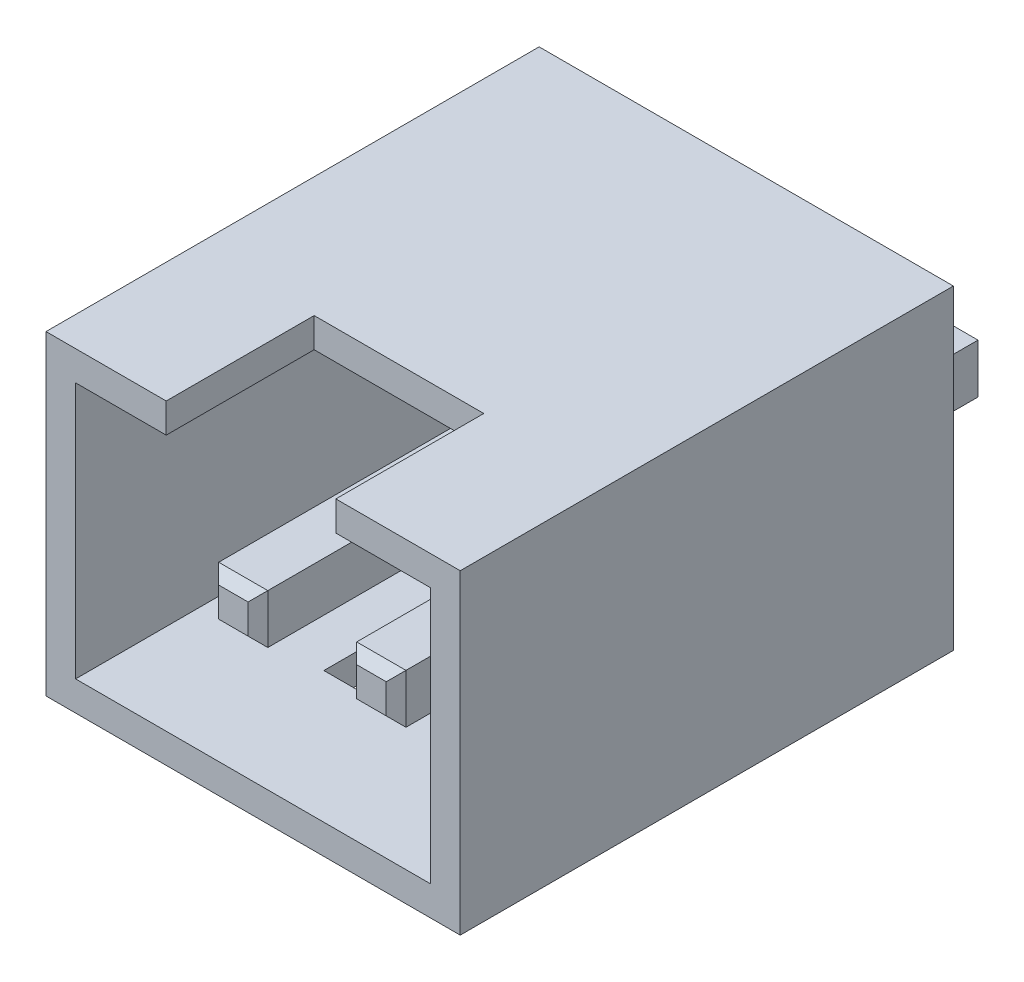
from build123d import *

# Parameters (mm, degrees)
SKETCH_1_W           = 4.2
SKETCH_1_H           = 3.2
EXTRUDE_1_DEPTH      = 5
SKETCH_2_W           = 3.6
SKETCH_2_H           = 2.6
CUT_EXTRUDE_2_DEPTH  = 4.5
SKETCH_10_W          = 1.719860591
SKETCH_10_H          = 0.3
CUT_EXTRUDE_6_DEPTH  = 1.5
EXTRUDE_2_DEPTH      = 4
EXTRUDE_2_DEPTH_BACK = 2
SKETCH_12_W          = 0.497980778
SKETCH_12_H          = 0.499968878
SKETCH_12_W_2        = 0.49954636
CHAMFER_2_SIZE       = 0.1
CHAMFER_3_SIZE       = 0.1
SKETCH_13_W          = 0.786936725
SKETCH_13_H          = 0.841611244
CUT_EXTRUDE_7_DEPTH  = 0.5


with BuildPart() as part:
    # 草图1 → 凸台-拉伸1 (new body)
    with BuildSketch(Plane.XY):
        Rectangle(SKETCH_1_W, SKETCH_1_H)
    extrude(amount=EXTRUDE_1_DEPTH)

    # 草图2 → 切除-拉伸2 (cut)
    with BuildSketch(Plane.XY.offset(5)):
        Rectangle(SKETCH_2_W, SKETCH_2_H)
    extrude(amount=-CUT_EXTRUDE_2_DEPTH, mode=Mode.SUBTRACT)

    # 草图10 → 切除-拉伸6 (cut)
    with BuildSketch(Plane.XY.offset(5)):
        with Locations((-0.021149262, 1.45)):
            Rectangle(SKETCH_10_W, SKETCH_10_H)
    extrude(amount=-CUT_EXTRUDE_6_DEPTH, mode=Mode.SUBTRACT)

    # 草图12 → 凸台-拉伸2 (add, two sides: drawn at the far end of the back side and taken through both)
    with BuildSketch(Plane.XY.offset(0.5).offset(-EXTRUDE_2_DEPTH_BACK)):
        with Locations((-0.7, -0.4)):
            Rectangle(SKETCH_12_W, SKETCH_12_H)
        with Locations((0.7, -0.4)):
            Rectangle(SKETCH_12_W_2, SKETCH_12_H)
    extrude(amount=EXTRUDE_2_DEPTH + EXTRUDE_2_DEPTH_BACK)

    # 倒角2
    chamfer_2_edges = [part.edges().sort_by_distance(p)[0] for p in [
        (-0.451009611, -0.4, 4.5),
        (-0.7, -0.150015561, 4.5),
        (-0.948990389, -0.4, 4.5),
        (-0.7, -0.649984439, 4.5),
        (0.94977318, -0.4, 4.5),
        (0.7, -0.150015561, 4.5),
        (0.45022682, -0.4, 4.5),
        (0.7, -0.649984439, 4.5),
    ]]
    chamfer(chamfer_2_edges, length=CHAMFER_2_SIZE)

    # 倒角3
    chamfer_3_edges = [part.edges().sort_by_distance(p)[0] for p in [
        (-0.451009611, -0.4, -1.5),
        (-0.7, -0.649984439, -1.5),
        (-0.948990389, -0.4, -1.5),
        (-0.7, -0.150015561, -1.5),
        (0.94977318, -0.4, -1.5),
        (0.7, -0.649984439, -1.5),
        (0.45022682, -0.4, -1.5),
        (0.7, -0.150015561, -1.5),
    ]]
    chamfer(chamfer_3_edges, length=CHAMFER_3_SIZE)

    # 草图13 → 切除-拉伸7 (cut)
    with BuildSketch(Plane.XZ.offset(1.6)):
        with Locations((-0.221312495, 3.247007401)):
            Rectangle(SKETCH_13_W, SKETCH_13_H)
    extrude(amount=-CUT_EXTRUDE_7_DEPTH, mode=Mode.SUBTRACT)


solid = part.part
